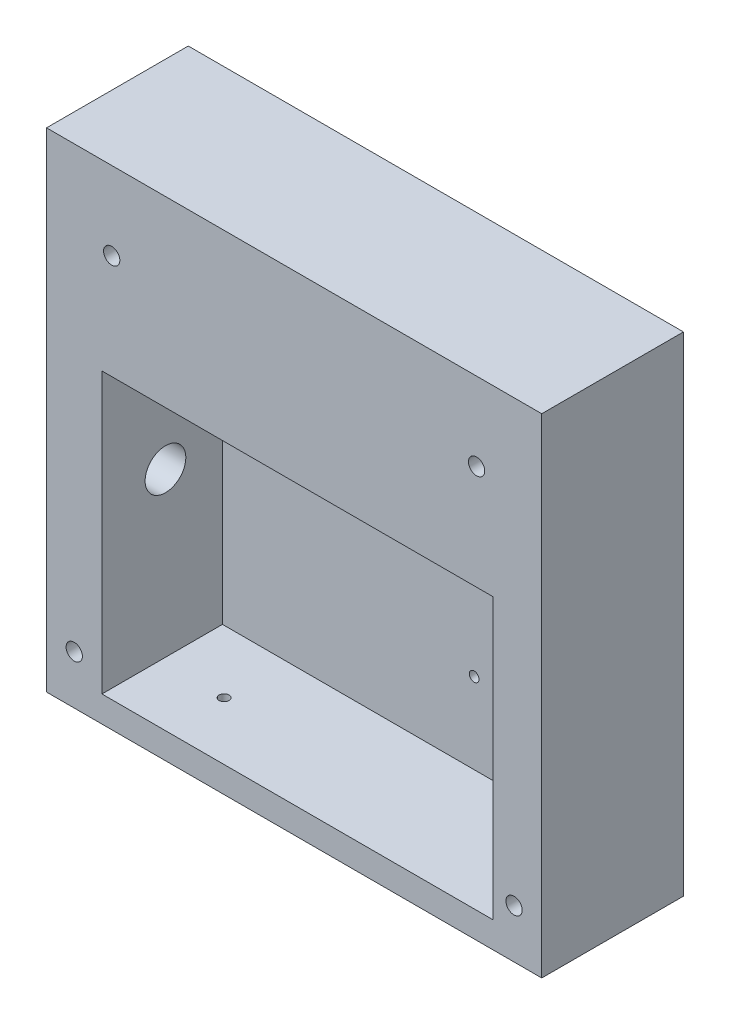
from build123d import *

# Parameters (mm, degrees)
SKETCH1_W           = 152
SKETCH1_H           = 150
BOSS_EXTRUDE1_DEPTH = 6.5
SKETCH2_W           = 152
SKETCH2_H           = 8
BOSS_EXTRUDE2_DEPTH = 37
SKETCH3_W           = 17
SKETCH3_H           = 142
BOSS_EXTRUDE3_DEPTH = 37
SKETCH4_W           = 15
SKETCH4_H           = 142
BOSS_EXTRUDE4_DEPTH = 37
SKETCH5_W           = 120
SKETCH5_H           = 56.12
BOSS_EXTRUDE5_DEPTH = 37
HOLE2_D             = 3
HOLE2_DEPTH         = 8
HOLE2_CBORE_D       = 6
HOLE2_CBORE_DEPTH   = 4.5
HOLE3_D             = 3
HOLE3_DEPTH         = 8
HOLE3_CBORE_D       = 6
HOLE3_CBORE_DEPTH   = 4.5
HOLE4_D             = 12.5
HOLE4_DEPTH         = 17
HOLE5_D             = 3
HOLE5_CBORE_D       = 6
HOLE5_CBORE_DEPTH   = 4
HOLE6_D             = 3
HOLE6_CBORE_D       = 6
HOLE6_CBORE_DEPTH   = 4
HOLE7_D             = 3
HOLE7_CBORE_D       = 6
HOLE7_CBORE_DEPTH   = 4
HOLE9_D             = 5
HOLE9_CBORE_D       = 10
HOLE9_CBORE_DEPTH   = 23.5
HOLE10_D            = 5
HOLE10_CBORE_D      = 10
HOLE10_CBORE_DEPTH  = 23.5


with BuildPart() as part:
    # Sketch1 → Boss-Extrude1 (new body)
    with BuildSketch(Plane.XY):
        with Locations((76, 75)):
            Rectangle(SKETCH1_W, SKETCH1_H)
    extrude(amount=BOSS_EXTRUDE1_DEPTH)

    # Sketch2 → Boss-Extrude2 (add)
    with BuildSketch(Plane.XY.offset(6.5)):
        with Locations((76, 4)):
            Rectangle(SKETCH2_W, SKETCH2_H)
    extrude(amount=BOSS_EXTRUDE2_DEPTH)

    # Sketch3 → Boss-Extrude3 (add)
    with BuildSketch(Plane.XY.offset(6.5)):
        with Locations((8.5, 79)):
            Rectangle(SKETCH3_W, SKETCH3_H)
    extrude(amount=BOSS_EXTRUDE3_DEPTH)

    # Sketch4 → Boss-Extrude4 (add)
    with BuildSketch(Plane.XY.offset(6.5)):
        with Locations((144.5, 79)):
            Rectangle(SKETCH4_W, SKETCH4_H)
    extrude(amount=BOSS_EXTRUDE4_DEPTH)

    # Sketch5 → Boss-Extrude5 (add)
    with BuildSketch(Plane.XY.offset(6.5)):
        with Locations((77, 121.94)):
            Rectangle(SKETCH5_W, SKETCH5_H)
    extrude(amount=BOSS_EXTRUDE5_DEPTH)

    # Hole2
    with Locations(Plane(origin=(36.75, 0, 25.75), x_dir=(0, 0, -1), z_dir=(0, -1, 0))):
        with Locations((0, 0)):
            CounterBoreHole(HOLE2_D / 2, HOLE2_CBORE_D / 2, HOLE2_CBORE_DEPTH, depth=HOLE2_DEPTH)

    # Hole3
    with Locations(Plane(origin=(124.25, 0, 19.75), x_dir=(0, 0, -1), z_dir=(0, -1, 0))):
        with Locations((0, 0)):
            CounterBoreHole(HOLE3_D / 2, HOLE3_CBORE_D / 2, HOLE3_CBORE_DEPTH, depth=HOLE3_DEPTH)

    # Hole4
    with Locations(Plane(origin=(17, 58, 24), x_dir=(0, 1, 0), z_dir=(1, 0, 0))):
        with Locations((0, 0)):
            Hole(HOLE4_D / 2, depth=HOLE4_DEPTH)

    # Hole5 (through all)
    with Locations(Plane(origin=(94.25, 32.75, 0), x_dir=(-1, 0, 0), z_dir=(0, 0, -1))):
        with Locations((0, 0)):
            CounterBoreHole(HOLE5_D / 2, HOLE5_CBORE_D / 2, HOLE5_CBORE_DEPTH)

    # Hole6 (through all)
    with Locations(Plane(origin=(94.25, 60.75, 0), x_dir=(-1, 0, 0), z_dir=(0, 0, -1))):
        with Locations((0, 0)):
            CounterBoreHole(HOLE6_D / 2, HOLE6_CBORE_D / 2, HOLE6_CBORE_DEPTH)

    # Hole7 (through all)
    with Locations(Plane(origin=(59, 60.75, 0), x_dir=(-1, 0, 0), z_dir=(0, 0, -1))):
        with Locations((0, 0)):
            CounterBoreHole(HOLE7_D / 2, HOLE7_CBORE_D / 2, HOLE7_CBORE_DEPTH)

    # Hole9 (through all)
    with Locations(Plane(origin=(132, 126, 0), x_dir=(-1, 0, 0), z_dir=(0, 0, -1))):
        with Locations((0, 0), (112, 0)):
            CounterBoreHole(HOLE9_D / 2, HOLE9_CBORE_D / 2, HOLE9_CBORE_DEPTH)

    # Hole10 (through all)
    with Locations(Plane(origin=(143.5, 15, 0), x_dir=(-1, 0, 0), z_dir=(0, 0, -1))):
        with Locations((0, 0), (135, 0)):
            CounterBoreHole(HOLE10_D / 2, HOLE10_CBORE_D / 2, HOLE10_CBORE_DEPTH)


solid = part.part
